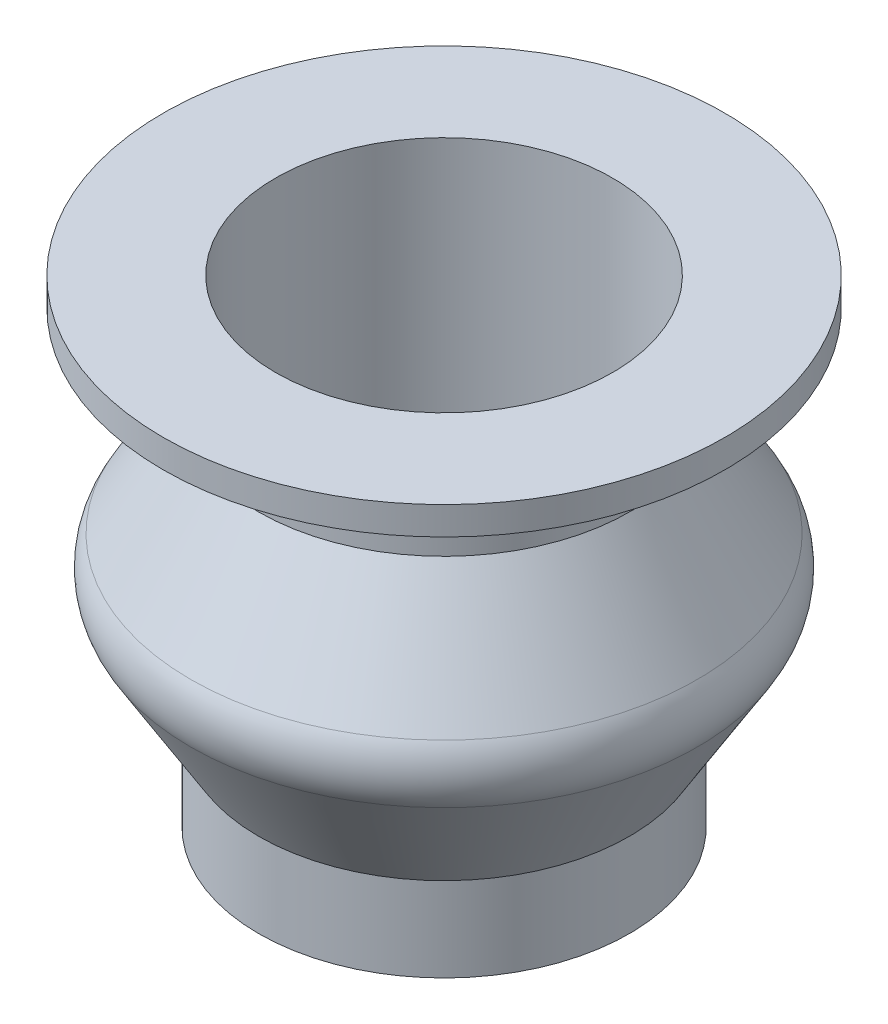
from build123d import *

# Parameters (mm, degrees)
CUT_EXTRUDE1_DEPTH      = 84.815273071
CUT_EXTRUDE1_DEPTH_BACK = 84.815273071
SKETCH3_R               = 30


with BuildPart() as part:
    # Sketch1 → Revolve1 (revolve)
    with BuildSketch(Plane.XY, mode=Mode.PRIVATE) as revolve1_sk:
        with BuildLine():
            Line((0, 45), (-50, 45))
            Line((-50, 45), (-50, 40))
            Line((-50, 40), (-35, 40))
            Line((-35, 40), (-35, 35))
            Line((-35, 35), (-33, 35))
            Line((-33, 35), (-33, 25))
            Line((-33, 25), (-45.073826017, 5.207769821))
            ThreePointArc((-45.073826017, 5.207769821), (-46.536898379, 0), (-45.073826017, -5.207769821))
            Line((-45.073826017, -5.207769821), (-33, -25))
            Line((-33, -25), (-33, -40))
            Line((-33, -40), (0, -40))
            Line((0, -40), (0, 45))
        make_face()
    revolve(revolve1_sk.sketch.rotate(Axis((0, 78.93258427, 0), (0, -1, 0)), 270), axis=Axis((0, 78.93258427, 0), (0, -1, 0)))

    # Sketch3 → Cut-Extrude1 (cut, two sides: drawn at the far end of the back side and taken through both)
    with BuildSketch(Plane(origin=(0, 0, 0), x_dir=(1, 0, 0), z_dir=(0, 1, 0)).offset(-CUT_EXTRUDE1_DEPTH_BACK)):
        with Locations(Location((0, 0, 0), (0, 0, 270))):
            Circle(SKETCH3_R)
    extrude(amount=CUT_EXTRUDE1_DEPTH + CUT_EXTRUDE1_DEPTH_BACK, mode=Mode.SUBTRACT)


solid = part.part
